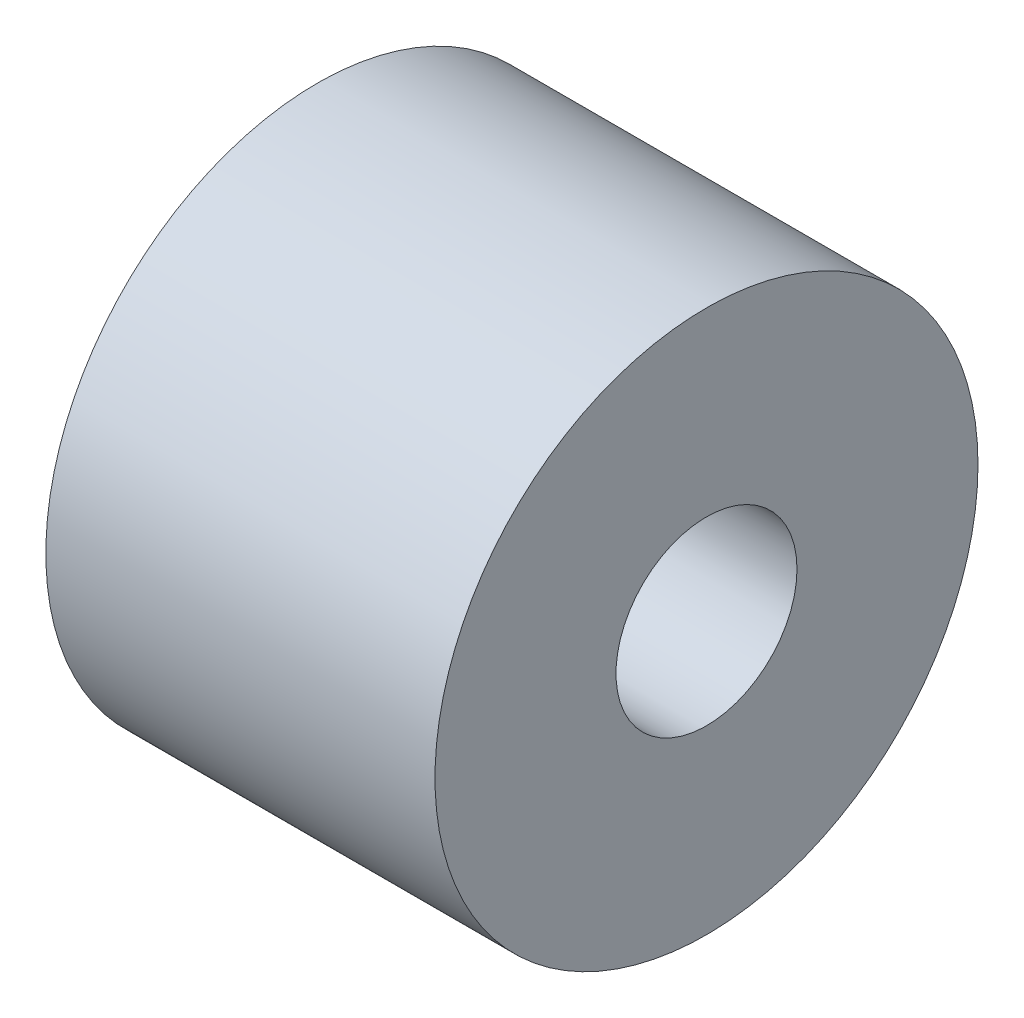
from build123d import *

# Parameters (mm, degrees)
SKETCH_1_R      = 15
SKETCH_1_R_2    = 5
EXTRUDE_1_DEPTH = 21.5


with BuildPart() as part:
    # Эскиз1 → Вытянуть1 (new body)
    with BuildSketch(Plane(origin=(0, 0, 0), x_dir=(0, 0, -1), z_dir=(1, 0, 0))):
        Circle(SKETCH_1_R)
        Circle(SKETCH_1_R_2, mode=Mode.SUBTRACT)
    extrude(amount=EXTRUDE_1_DEPTH)


solid = part.part
